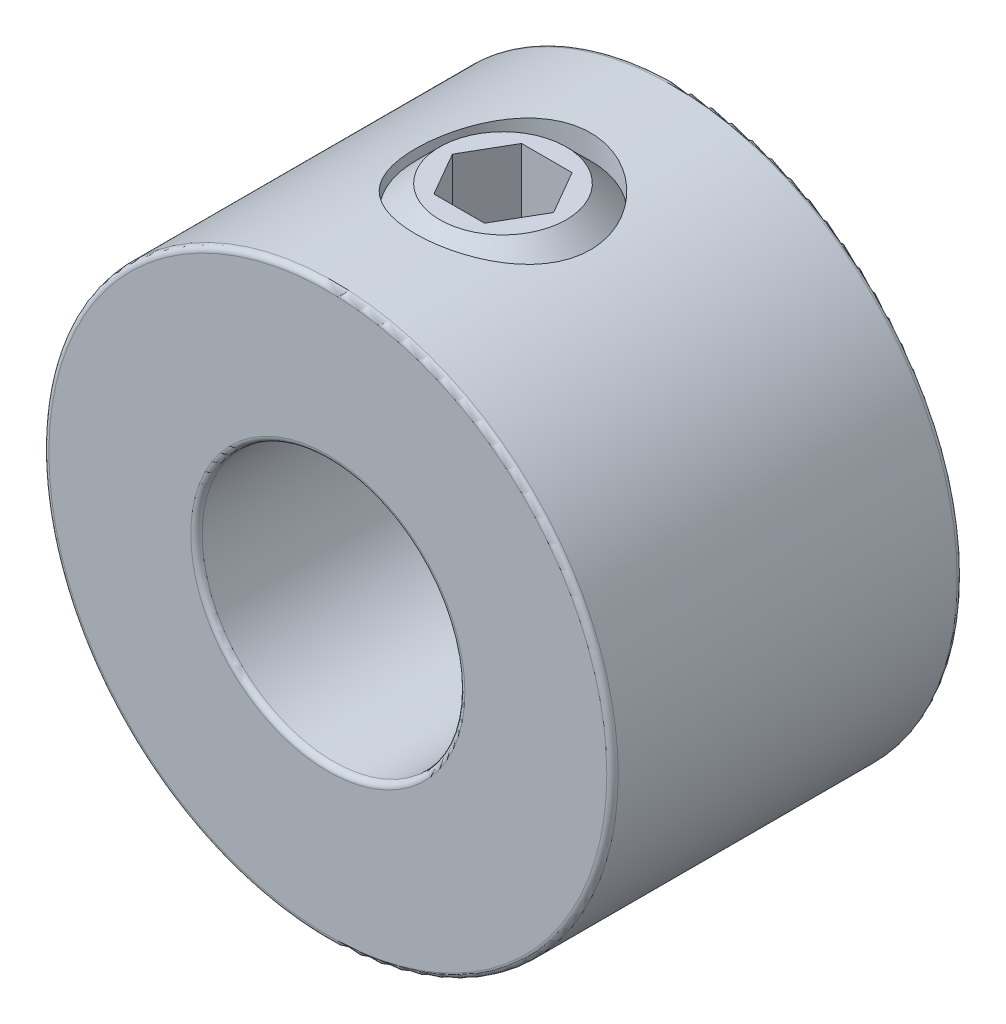
from build123d import *

# Parameters (mm, degrees)
SKETCH1_R               = 6.5
SKETCH1_R_2             = 3
EXTRUDE1_DEPTH          = 8
CUT_EXTRUDE1_REACH      = 18.591
CUT_EXTRUDE1_END_RADIUS = 3
SKETCH2_R               = 2
CUT_EXTRUDE2_DEPTH      = 1.6
FILLET1_R               = 0.13


with BuildPart() as part:
    # Sketch1 → Extrude1 (new body)
    with BuildSketch(Plane.XY):
        Circle(SKETCH1_R)
        Circle(SKETCH1_R_2, mode=Mode.SUBTRACT)
    extrude(amount=EXTRUDE1_DEPTH)

    # Cut-Extrude1: up to this cylinder (the profile starts outside it)
    cut_extrude1_end = Plane(origin=(0, 0, 4), z_dir=(0, 0, -1)) * Cylinder(CUT_EXTRUDE1_END_RADIUS, 44.182, mode=Mode.PRIVATE)
    # Sketch2 → Cut-Extrude1 (cut, up to the surface)
    with BuildSketch(Plane(origin=(0, 6.5, 0), x_dir=(-1, 0, 0), z_dir=(0, 1, 0)), mode=Mode.PRIVATE) as cut_extrude1_sk1:
        with Locations(Location((0, 4, 0), (0, 0, 90))):
            Circle(SKETCH2_R)
    cut_extrude1_tool1 = extrude(cut_extrude1_sk1.sketch, amount=-CUT_EXTRUDE1_REACH, mode=Mode.PRIVATE) - cut_extrude1_end
    add(cut_extrude1_tool1.solids().sort_by_distance((0, 6.5, 4))[0], mode=Mode.SUBTRACT)

    # Fillet1
    fillet1_edges = [part.edges().sort_by_distance(p)[0] for p in [
        (-6.5, 0, 0),
        (-6.5, 0, 8),
        (-3, 0, 0),
        (-3, 0, 8),
    ]]
    fillet(fillet1_edges, radius=FILLET1_R)


with BuildPart() as body_2:
    # Sketch3 → Revolve1 (revolve)
    with BuildSketch(Plane.XY.offset(4), mode=Mode.PRIVATE) as revolve1_sk:
        Polygon((-1.443375673, 6.5), (-2, 5.943375673), (-2, 3.056624327), (-1.443375673, 2.5), (-0.5, 2.5), (0, 3.366025404), (0, 6.5), align=None)
    revolve(revolve1_sk.sketch.rotate(Axis((0, 3.366025404, 4), (0, 1, 0)), 180), axis=Axis((0, 3.366025404, 4), (0, 1, 0)))

    # Sketch4 → Cut-Extrude2 (cut)
    with BuildSketch(Plane(origin=(0, 6.5, 0), x_dir=(0, 0, -1), z_dir=(0, 1, 0))):
        Polygon((-4, 1.154700538), (-5, 0.577350269), (-5, -0.577350269), (-4, -1.154700538), (-3, -0.577350269), (-3, 0.577350269), align=None)
    extrude(amount=-CUT_EXTRUDE2_DEPTH, mode=Mode.SUBTRACT)


solid = Compound([part.part, body_2.part])
